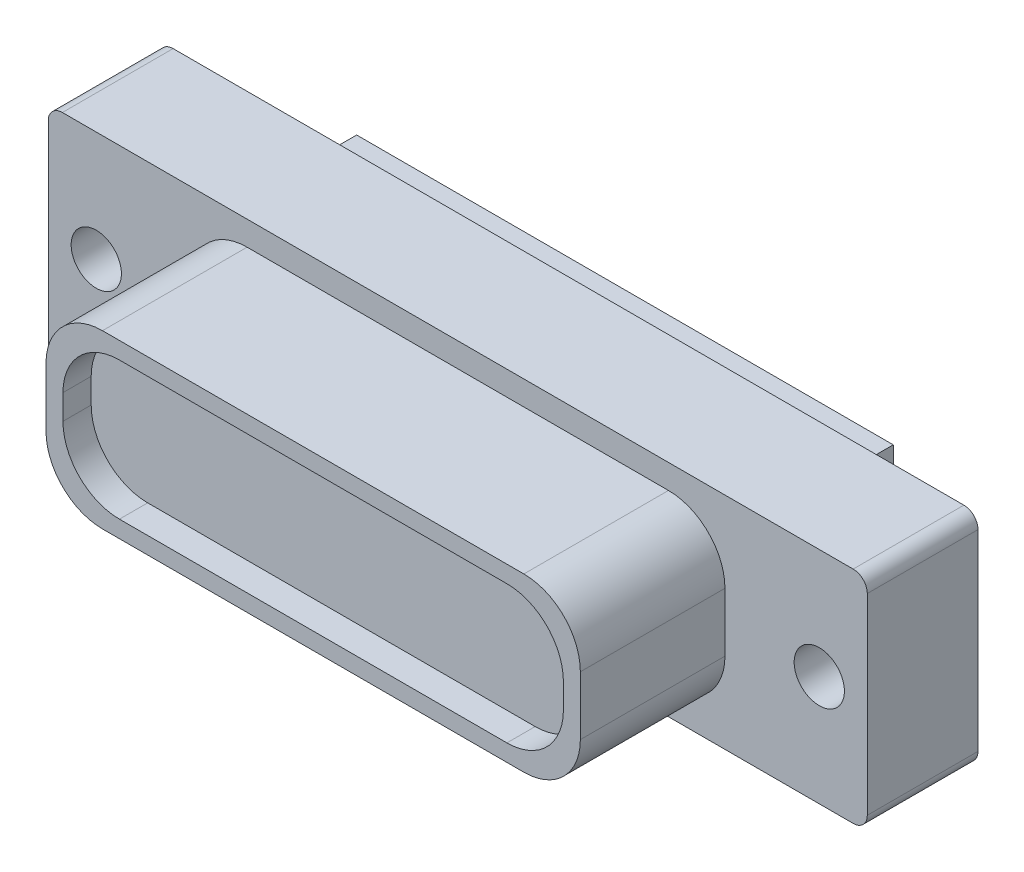
from build123d import *

# Parameters (mm, degrees)
SKETCH1_W                 = 36.83
SKETCH1_H                 = 9.906
BASE_DEPTH                = 4.9784
BOSS_EXTRUDE2_DEPTH       = 6.5024
F_4_40_TAPPED_HOLE1_D     = 2.2606
F_4_40_TAPPED_HOLE1_DEPTH = 7.5946
F_4_40_TAPPED_HOLE1_TIP   = 0.679152758
SKETCH5_W                 = 24.13
SKETCH5_H                 = 6.35
BOSS_EXTRUDE3_DEPTH       = 2.54
CUT_EXTRUDE1_DEPTH        = 1.27
FILLET1_R                 = 0.635


with BuildPart() as part:
    # Sketch1 → Base (new body)
    with BuildSketch(Plane.XY):
        Rectangle(SKETCH1_W, SKETCH1_H)
    extrude(amount=BASE_DEPTH)

    # Sketch2 → Boss-Extrude2 (add)
    with BuildSketch(Plane.XY.offset(4.9784)):
        with BuildLine():
            Line((-9.4742, -3.8608), (9.4742, -3.8608))
            ThreePointArc((9.4742, -3.8608), (11.270251224, -3.116851224), (12.0142, -1.3208))
            Line((12.0142, -1.3208), (12.0142, 1.3208))
            ThreePointArc((12.0142, 1.3208), (11.270251224, 3.116851224), (9.4742, 3.8608))
            Line((9.4742, 3.8608), (-9.4742, 3.8608))
            ThreePointArc((-9.4742, 3.8608), (-11.270251224, 3.116851224), (-12.0142, 1.3208))
            Line((-12.0142, 1.3208), (-12.0142, -1.3208))
            ThreePointArc((-12.0142, -1.3208), (-11.270251224, -3.116851224), (-9.4742, -3.8608))
        make_face()
    extrude(amount=BOSS_EXTRUDE2_DEPTH)

    # #4-40 Tapped Hole1
    with Locations(Plane.XY.offset(4.9784)):
        with Locations((-16.256, 0), (16.256, 0)):
            Hole(F_4_40_TAPPED_HOLE1_D / 2, depth=F_4_40_TAPPED_HOLE1_DEPTH)
            with Locations((0, 0, -(F_4_40_TAPPED_HOLE1_DEPTH + F_4_40_TAPPED_HOLE1_TIP / 2))):  # 118° drill point
                Cone(0, F_4_40_TAPPED_HOLE1_D / 2, F_4_40_TAPPED_HOLE1_TIP, mode=Mode.SUBTRACT)

    # Sketch5 → Boss-Extrude3 (add)
    with BuildSketch(Plane(origin=(0, 0, 0), x_dir=(-1, 0, 0), z_dir=(0, 0, -1))):
        Rectangle(SKETCH5_W, SKETCH5_H)
    extrude(amount=BOSS_EXTRUDE3_DEPTH)

    # Sketch6 → Cut-Extrude1 (cut)
    with BuildSketch(Plane.XY.offset(11.4808)):
        with BuildLine():
            Line((-8.7122, -3.0988), (8.7122, -3.0988))
            ThreePointArc((8.7122, -3.0988), (10.508251224, -2.354851224), (11.2522, -0.5588))
            Line((11.2522, -0.5588), (11.2522, 0.5588))
            ThreePointArc((11.2522, 0.5588), (10.508251224, 2.354851224), (8.7122, 3.0988))
            Line((8.7122, 3.0988), (-8.7122, 3.0988))
            ThreePointArc((-8.7122, 3.0988), (-10.508251224, 2.354851224), (-11.2522, 0.5588))
            Line((-11.2522, 0.5588), (-11.2522, -0.5588))
            ThreePointArc((-11.2522, -0.5588), (-10.508251224, -2.354851224), (-8.7122, -3.0988))
        make_face()
    extrude(amount=-CUT_EXTRUDE1_DEPTH, mode=Mode.SUBTRACT)

    # Fillet1
    fillet1_edges = [part.edges().sort_by_distance(p)[0] for p in [
        (18.415, -4.953, 2.4892),
        (-18.415, -4.953, 2.4892),
        (-18.415, 4.953, 2.4892),
        (18.415, 4.953, 2.4892),
    ]]
    fillet(fillet1_edges, radius=FILLET1_R)


solid = part.part
